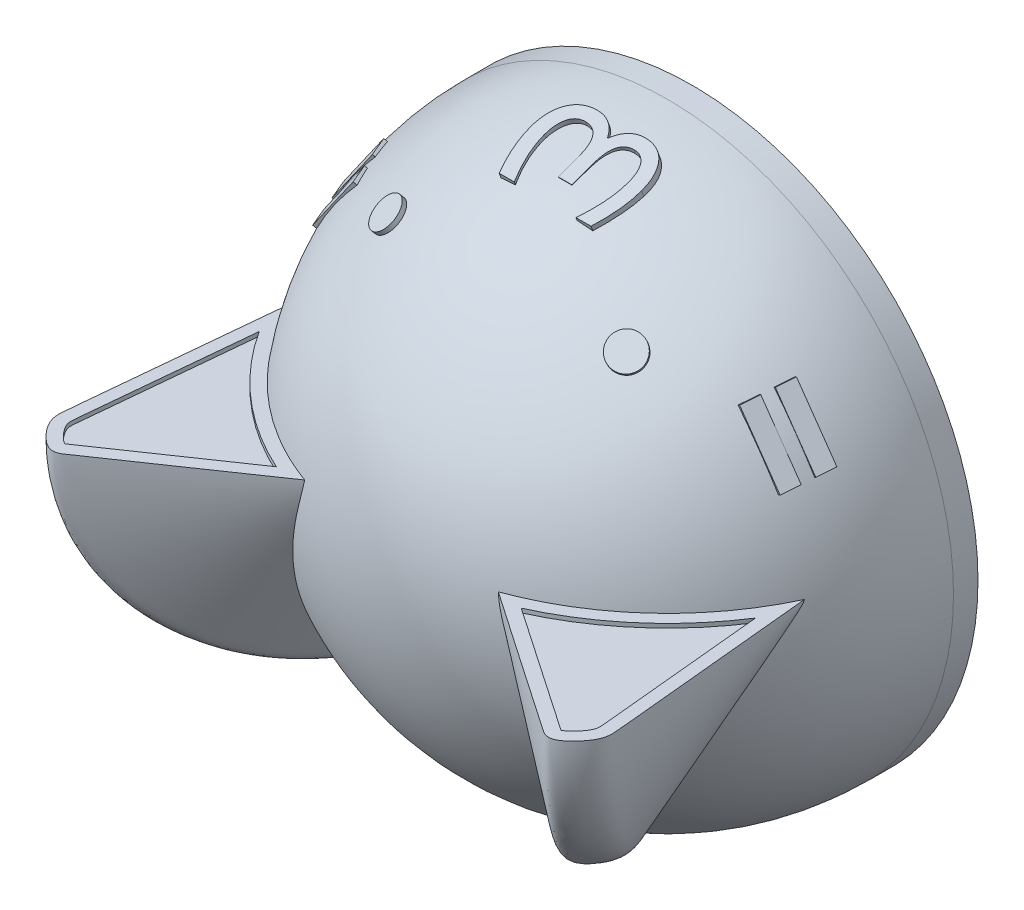
from build123d import *

# Parameters (mm, degrees)
SKETCH2_R                = 70
BOSS_EXTRUDE1_DEPTH      = 6
SKETCH1_W                = 97.753046998
SKETCH1_H                = 74.942266642
CUT_EXTRUDE1_DEPTH       = 5
DOME1_FACE_RADIUS        = 70
DOME1_HEIGHT             = 70
CUT_EXTRUDE2_DEPTH       = 1
SKETCH10_R               = 4
BOSS_EXTRUDE2_DEPTH      = 1
BOSS_EXTRUDE3_DEPTH      = 0.1
BOSS_EXTRUDE3_DEPTH_BACK = 2
BOSS_EXTRUDE4_START      = -2
SKETCH15_W               = 4.233333334
SKETCH15_H               = 17.258974358
BOSS_EXTRUDE4_DEPTH      = 2.1


with BuildPart() as part:
    # Sketch2 → Boss-Extrude1 (new body)
    with BuildSketch(Plane.XY):
        Circle(SKETCH2_R)
    extrude(amount=BOSS_EXTRUDE1_DEPTH)

    # Sketch1 → Cut-Extrude1 (cut)
    with BuildSketch(Plane.XY):
        with Locations((0, 8.936425244)):
            Rectangle(SKETCH1_W, SKETCH1_H)
    extrude(amount=CUT_EXTRUDE1_DEPTH, mode=Mode.SUBTRACT)

    # Dome1: a dome of height H over a round flat face of radius A is a cap of a sphere of radius (A * A + H * H) / (2 * H)
    dome1_r = (DOME1_FACE_RADIUS * DOME1_FACE_RADIUS + DOME1_HEIGHT * DOME1_HEIGHT) / (2 * DOME1_HEIGHT)
    dome1_base = Plane((0, 0, 6), z_dir=(0, 0, 1))
    with Locations(dome1_base.offset(DOME1_HEIGHT - dome1_r)):
        dome1_ball = Sphere(dome1_r, mode=Mode.PRIVATE)
    add(split(dome1_ball, bisect_by=dome1_base, keep=Keep.TOP, mode=Mode.PRIVATE))

    # Sweep1: sweep along a path in Sketch7
    with BuildLine(Plane(origin=(2.843391118, 0, 2.043377321), x_dir=(0.34056288688802433, -0.8120573336359775, -0.473898519688046), z_dir=(0.8120573336359777, -3.4694469519536138e-15, 0.5835776614025134))) as sweep1_path:
        ThreePointArc((-74.556178477, -86.610394542), (-36.555998568, -95.223223752), (-3.912796397, -73.948453433))
    # Sketch6 → Sweep1 (sweep)
    with BuildSketch(Plane(origin=(0, 10, 0), x_dir=(1, 0, 0), z_dir=(0, 1, 0))):
        with BuildLine():
            ThreePointArc((-62.790845378, -35.279852062), (-46.806262587, -57.080072265), (-23.695850618, -71.103814508))
            add(Edge.make_bspline(
                [(-62.790845378, -35.279852062), (-64.413642109, -52.061643681), (-66.03643884, -68.843435299), (-67.659235571, -85.625226918), (-67.801008234, -87.091337388), (-68.084553559, -90.023558329), (-61.52819335, -97.082597983), (-59.099722371, -95.415011014), (-57.885486882, -94.58121753), (-46.48894146, -86.755416523), (-35.092396039, -78.929615515), (-23.695850618, -71.103814508)],
                knots=[0, 0, 0, 0, 0.48029336, 0.48029336, 0.48029336, 0.52225331, 0.564213259, 0.606173208, 0.606173208, 0.606173208, 1, 1, 1, 1], degree=3))
        make_face()
    sweep1 = sweep(path=sweep1_path.line)

    # Mirror1: Sweep1 across plane
    add(sweep1.mirror(Plane(origin=(0, 0, 0), x_dir=(0, 0, 1), z_dir=(1, 0, 0))))

    # Sketch8 → Cut-Extrude2 (cut)
    with BuildSketch(Plane(origin=(0, 10, 0), x_dir=(1, 0, 0), z_dir=(0, 1, 0))):
        with BuildLine():
            Line((-60.705209196, -92.782955528), (-29.972724019, -71.774828078))
            ThreePointArc((-29.972724019, -71.774828078), (-47.261621449, -60.690322104), (-60.735243349, -45.190845987))
            add(Edge.make_bspline(
                [(-60.735243349, -45.190845987), (-61.527783767, -53.386726527), (-62.716594394, -65.680547336), (-64.004472574, -78.998853213), (-64.524577224, -84.377399817), (-64.648411664, -85.658006151), (-64.69794544, -86.170248685), (-64.723124688, -86.426348639), (-64.756873663, -86.939407012), (-64.765579964, -87.196358371), (-64.735644631, -87.712708273), (-64.694368394, -87.968191691), (-64.484898471, -88.700684674), (-64.23490359, -89.159454918), (-63.677737097, -90.01597251), (-63.367273806, -90.420135065), (-62.701381329, -91.194473113), (-62.344056438, -91.565735514), (-61.771734496, -92.078164663), (-61.574697488, -92.241875968), (-61.263592411, -92.469819308), (-61.157676189, -92.542578356), (-60.99407379, -92.643171956), (-60.93873231, -92.675313579), (-60.825315438, -92.734891309), (-60.768023509, -92.763675886), (-60.705209196, -92.782955528)],
                knots=[0, 0, 0, 0, 0.5, 0.75, 0.8125, 0.828125, 0.828125, 0.84375, 0.84375, 0.859375, 0.859375, 0.875, 0.875, 0.90625, 0.90625, 0.9375, 0.9375, 0.96875, 0.96875, 0.984375, 0.984375, 0.9921875, 0.9921875, 0.99609375, 0.99609375, 1, 1, 1, 1], degree=3))
        make_face()
    cut_extrude2 = extrude(amount=-CUT_EXTRUDE2_DEPTH, mode=Mode.SUBTRACT)

    # Mirror2: Cut-Extrude2 across plane
    add(cut_extrude2.mirror(Plane(origin=(0, 0, 0), x_dir=(0, 0, 1), z_dir=(1, 0, 0))), mode=Mode.SUBTRACT)

    # Sketch10 → Boss-Extrude2 (add, symmetric)
    with BuildSketch(Plane(origin=(-29.064583259, 50.341334905, 45), x_dir=(0.9097141810322431, 0.3313967182595154, 0.25019257374202497), z_dir=(-0.41520833226667586, 0.7191619272118206, 0.557142857142857))):
        with Locations(Location((0, 0, 0), (0, 0, 89.703587046))):
            Circle(SKETCH10_R)
    boss_extrude2 = extrude(amount=BOSS_EXTRUDE2_DEPTH, both=True)

    # Mirror3: Boss-Extrude2 across plane
    add(boss_extrude2.mirror(Plane(origin=(0, 0, 0), x_dir=(0, 0, 1), z_dir=(1, 0, 0))))

    # Sketch13 → Boss-Extrude3 (add, two sides: drawn at the far end of the back side and taken through both)
    with BuildSketch(Plane(origin=(0, 65.757128891, 30), x_dir=(1, 0, 0), z_dir=(0, 0.9393875555870628, 0.34285714285714286)).offset(-BOSS_EXTRUDE3_DEPTH_BACK)):
        with BuildLine():
            Line((0.178163953, 9.835052081), (0.104802325, 9.835052081))
            add(Edge.make_bspline(
                [(0.104802325, 9.835052081), (-0.062708686, 10.124459954), (-0.38795424, 10.686384949), (-0.981411621, 11.429744857), (-1.630894149, 12.060506185), (-2.337111555, 12.584460839), (-3.115734766, 12.977660879), (-3.947607573, 13.270306547), (-4.843869334, 13.438792541), (-5.459508532, 13.460554472), (-5.774608134, 13.471692775)],
                knots=[0, 0, 0, 0, 1.098842817, 2.133553716, 3.116972993, 4.070907673, 5.014068788, 5.97539929, 6.96375851, 8, 8, 8, 8], degree=3))
            add(Edge.make_bspline(
                [(-5.774608134, 13.471692775), (-6.072018473, 13.465994), (-6.653712616, 13.45484797), (-7.500923405, 13.328324599), (-8.298622081, 13.137815146), (-9.048212363, 12.870349544), (-9.741840838, 12.514646551), (-10.39173852, 12.089904369), (-10.988107998, 11.582500633), (-11.525051656, 10.997256771), (-12.013478596, 10.355676636), (-12.432869852, 9.652774863), (-12.791726211, 8.901063086), (-13.078414017, 8.094114462), (-13.303129219, 7.238428314), (-13.464443672, 6.330807088), (-13.56684145, 5.371081573), (-13.577118646, 4.712233362), (-13.582381383, 4.374850923)],
                knots=[0, 0, 0, 0, 1.053146694, 2.059811588, 3.028124428, 3.956213283, 4.872482307, 5.784077154, 6.701850246, 7.639140525, 8.593604952, 9.554290973, 10.534401911, 11.540762287, 12.584205552, 13.665993529, 14.804803922, 16, 16, 16, 16], degree=3))
            add(Edge.make_bspline(
                [(-13.582381383, 4.374850923), (-13.57517001, 3.960644441), (-13.560570673, 3.12208855), (-13.44450665, 1.850437163), (-13.262307666, 0.552524859), (-13.002284113, -0.772583486), (-12.673017646, -2.12283039), (-12.265329406, -3.499382231), (-11.791173982, -4.904357839), (-11.422287028, -5.839648014), (-11.234809292, -6.314986277)],
                knots=[0, 0, 0, 0, 0.902659598, 1.827423176, 2.780922723, 3.758262312, 4.769335252, 5.808961214, 6.886458342, 8, 8, 8, 8], degree=3))
            Line((-11.234809292, -6.314986277), (-7.545767435, -6.314986277))
            add(Edge.make_bspline(
                [(-7.545767435, -6.314986277), (-7.759557058, -5.827653385), (-8.178369252, -4.872972072), (-8.723597993, -3.439008625), (-9.185030145, -2.04191852), (-9.56593563, -0.680405046), (-9.860685391, 0.645511916), (-10.070800043, 1.936538066), (-10.203345146, 3.191297494), (-10.220349799, 4.016469778), (-10.228706968, 4.422011969)],
                knots=[0, 0, 0, 0, 1.145544815, 2.244113302, 3.301277214, 4.312163021, 5.286580206, 6.223796513, 7.127060534, 8, 8, 8, 8], degree=3))
            add(Edge.make_bspline(
                [(-10.228706968, 4.422011969), (-10.226330896, 4.649199977), (-10.22171809, 5.090253285), (-10.167541327, 5.734213371), (-10.08148355, 6.340469602), (-9.953074113, 6.910426515), (-9.798456156, 7.445960931), (-9.606264412, 7.945349215), (-9.371262536, 8.403836364), (-9.112839389, 8.830901053), (-8.814413581, 9.211131184), (-8.488341723, 9.549153354), (-8.122376372, 9.824381868), (-7.734312478, 10.061974488), (-7.306965479, 10.230642737), (-6.857722567, 10.366086761), (-6.372493257, 10.437729999), (-6.04031068, 10.448057573), (-5.868930227, 10.453385801)],
                knots=[0, 0, 0, 0, 1.298985415, 2.521796016, 3.692959936, 4.798147583, 5.860237747, 6.87868061, 7.852596325, 8.803493108, 9.72869888, 10.611685708, 11.480832742, 12.340861588, 13.205346123, 14.100009316, 15.019752133, 16, 16, 16, 16], degree=3))
            add(Edge.make_bspline(
                [(-5.868930227, 10.453385801), (-5.692260871, 10.448212362), (-5.349556264, 10.438176885), (-4.851664385, 10.364599231), (-4.389101504, 10.239221968), (-3.960137806, 10.064332201), (-3.562755839, 9.844995211), (-3.203015759, 9.567435906), (-2.877080344, 9.241617216), (-2.58848604, 8.864443207), (-2.32844043, 8.442896703), (-2.111973967, 7.967585636), (-1.92062927, 7.446449528), (-1.773108865, 6.873442683), (-1.650362321, 6.252707894), (-1.571138257, 5.581690734), (-1.515679881, 4.861369672), (-1.511377693, 4.364489273), (-1.509153487, 4.107604993)],
                knots=[0, 0, 0, 0, 0.969563035, 1.88076599, 2.755316341, 3.593914439, 4.418082895, 5.238842334, 6.079520644, 6.940618016, 7.840093159, 8.792340321, 9.802350959, 10.883787029, 12.036449509, 13.273250476, 14.590286329, 16, 16, 16, 16], degree=3))
            Line((-1.509153487, 4.107604993), (-1.509153487, -1.284474654))
            Line((-1.509153487, -1.284474654), (1.844520929, -1.284474654))
            Line((1.844520929, -1.284474654), (1.844520929, 4.107604993))
            add(Edge.make_bspline(
                [(1.844520929, 4.107604993), (1.847450855, 4.364434108), (1.853116708, 4.861086967), (1.899028562, 5.582032542), (1.98261067, 6.252009726), (2.097060913, 6.873531968), (2.24242878, 7.444821178), (2.41897933, 7.96891347), (2.634832954, 8.439192825), (2.875041675, 8.865931726), (3.155332405, 9.238875341), (3.464335666, 9.569236178), (3.812680396, 9.841177196), (4.190888285, 10.066076554), (4.602379469, 10.237874117), (5.045146957, 10.364894445), (5.522408714, 10.438159474), (5.851210979, 10.448202809), (6.020893599, 10.453385801)],
                knots=[0, 0, 0, 0, 1.432070032, 2.769318711, 4.025733851, 5.19485186, 6.290974372, 7.310509822, 8.273780032, 9.172603342, 10.035564659, 10.869169666, 11.687556909, 12.491028573, 13.315939233, 14.166833663, 15.053971029, 16, 16, 16, 16], degree=3))
            add(Edge.make_bspline(
                [(6.020893599, 10.453385801), (6.181789426, 10.44758505), (6.496299281, 10.436246077), (6.954504109, 10.370269747), (7.38594185, 10.24791694), (7.787519199, 10.074110288), (8.16678065, 9.858178773), (8.513216871, 9.587359938), (8.834488667, 9.270555435), (9.128979665, 8.907440187), (9.390443985, 8.497798395), (9.616288661, 8.044394543), (9.80409668, 7.546830398), (9.961455399, 7.007499019), (10.079738032, 6.421683798), (10.168744456, 5.793706474), (10.221407634, 5.121599416), (10.226227419, 4.659658529), (10.228706968, 4.422011969)],
                knots=[0, 0, 0, 0, 0.930887983, 1.819645976, 2.670377008, 3.516777367, 4.345136016, 5.187849918, 6.052328744, 6.950171382, 7.886253635, 8.857708472, 9.874698624, 10.958595469, 12.103899319, 13.328417598, 14.625598243, 16, 16, 16, 16], degree=3))
            add(Edge.make_bspline(
                [(10.228706968, 4.422011969), (10.220349799, 4.016469778), (10.203345146, 3.191297494), (10.070800043, 1.936538066), (9.860685391, 0.645511916), (9.56593563, -0.680405046), (9.185030145, -2.04191852), (8.723597993, -3.439008625), (8.178369252, -4.872972072), (7.759557058, -5.827653385), (7.545767435, -6.314986277)],
                knots=[0, 0, 0, 0, 0.872939466, 1.776203487, 2.713419794, 3.687836979, 4.698722786, 5.755886698, 6.854455185, 8, 8, 8, 8], degree=3))
            Line((7.545767435, -6.314986277), (11.234809292, -6.314986277))
            add(Edge.make_bspline(
                [(11.234809292, -6.314986277), (11.422139194, -5.834342617), (11.790217125, -4.889942804), (12.265728488, -3.473234652), (12.671346435, -2.08916167), (13.002616245, -0.735981634), (13.261169657, 0.585887912), (13.444645113, 1.876577585), (13.560358197, 3.136058222), (13.575110844, 3.9658869), (13.582381383, 4.374850923)],
                knots=[0, 0, 0, 0, 1.124399118, 2.209292256, 3.256402619, 4.267646581, 5.245151488, 6.191272295, 7.108605696, 8, 8, 8, 8], degree=3))
            add(Edge.make_bspline(
                [(13.582381383, 4.374850923), (13.576608698, 4.708701648), (13.565311226, 5.362066346), (13.469396048, 6.316583429), (13.314089538, 7.220844929), (13.094011937, 8.074809555), (12.810256608, 8.877085878), (12.471697337, 9.633194399), (12.058316324, 10.333109696), (11.58871715, 10.982448737), (11.063469824, 11.57187739), (10.474537551, 12.076284839), (9.841969436, 12.513638538), (9.151462841, 12.862930955), (8.411647991, 13.138753069), (7.621371666, 13.327939253), (6.781349839, 13.455488996), (6.203053554, 13.466189202), (5.905611041, 13.471692775)],
                knots=[0, 0, 0, 0, 1.190916007, 2.330689793, 3.41879168, 4.461768451, 5.472923551, 6.451857449, 7.412751671, 8.367624724, 9.307513704, 10.222103161, 11.127880949, 12.044866594, 12.975599279, 13.938431685, 14.939647243, 16, 16, 16, 16], degree=3))
            add(Edge.make_bspline(
                [(5.905611041, 13.471692775), (5.593994483, 13.460619387), (4.986982381, 13.43904903), (4.106005911, 13.271039533), (3.293165666, 12.977710642), (2.534886424, 12.582390547), (1.84577762, 12.061383021), (1.216617426, 11.430092265), (0.650458085, 10.68334204), (0.339044336, 10.124010177), (0.178163953, 9.835052081)],
                knots=[0, 0, 0, 0, 1.041721572, 2.029216947, 2.984413573, 3.922453251, 4.878078425, 5.86110649, 6.89501987, 8, 8, 8, 8], degree=3))
        make_face()
    extrude(amount=BOSS_EXTRUDE3_DEPTH + BOSS_EXTRUDE3_DEPTH_BACK)

    # Sketch15 → Boss-Extrude4 (add)
    with BuildSketch(Plane(origin=(-53.865086558, 37.716739654, 30), x_dir=(0.2808521294705121, -0.1966547781775009, 0.9393875555870627), z_dir=(-0.7695012365387827, 0.5388105664861458, 0.342857142857143)).offset(BOSS_EXTRUDE4_START)):
        with Locations((3.8703896, 0)):
            Rectangle(SKETCH15_W, SKETCH15_H)
        with Locations((-3.293712964, 0)):
            Rectangle(SKETCH15_W, SKETCH15_H)
    boss_extrude4 = extrude(amount=BOSS_EXTRUDE4_DEPTH)

    # Mirror4: Boss-Extrude4 across plane
    add(boss_extrude4.mirror(Plane(origin=(0, 0, 0), x_dir=(0, 0, 1), z_dir=(1, 0, 0))))


solid = part.part
